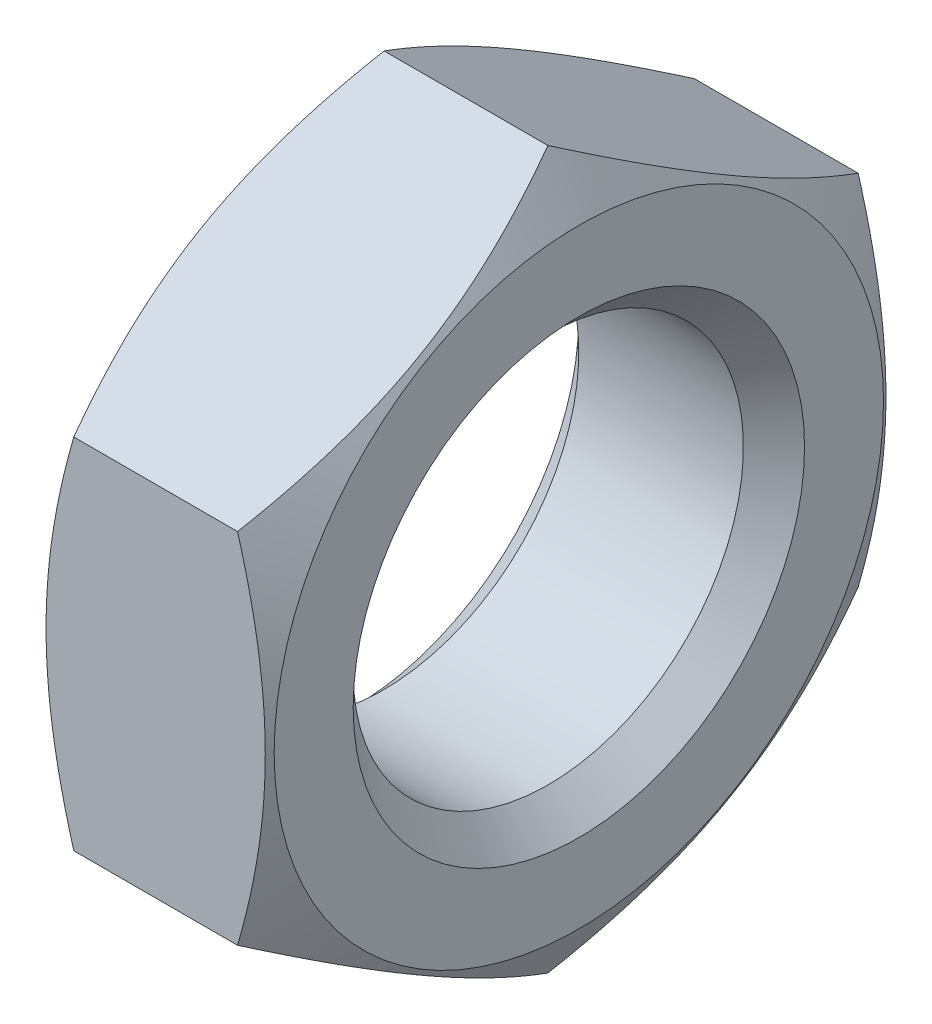
from build123d import *

# Parameters (mm, degrees)
EXTRUDE_1_DEPTH      = 2
EXTRUDE_1_DEPTH_BACK = 2


with BuildPart() as part:
    # 草图1 → 凸台-拉伸1 (new, two sides: drawn at the far end of the back side and taken through both)
    with BuildSketch(Plane(origin=(0, 0, 0), x_dir=(0, 0, -1), z_dir=(1, 0, 0)).offset(-EXTRUDE_1_DEPTH_BACK)):
        Polygon((-5.5, -3.175426481), (0, -6.350852961), (5.5, -3.175426481), (5.5, 3.175426481), (0, 6.350852961), (-5.5, 3.175426481), align=None)
    extrude(amount=EXTRUDE_1_DEPTH + EXTRUDE_1_DEPTH_BACK)

    # 草图2 → 切除-旋转1 (revolve, cut)
    with BuildSketch(Plane.XY):
        Polygon((-2, 0), (-2, 4), (-1.4585, 3.4585), (1.4585, 3.4585), (2, 4), (2, 0), align=None)
    revolve(axis=Axis((2, 0, 0), (-1, 0, 0)), mode=Mode.SUBTRACT)

    # 草图3 → 切除-旋转2 (revolve, cut)
    with BuildSketch(Plane.XY):
        Polygon((-7, 1), (-2, 1), (-2, 5.4), (0, 8.864101615), (2, 5.4), (2, 1), (7, 1), (7, 13.4), (-7, 13.4), align=None)
    revolve(axis=Axis((50, 0, 0), (-1, 0, 0)), mode=Mode.SUBTRACT)


solid = part.part
